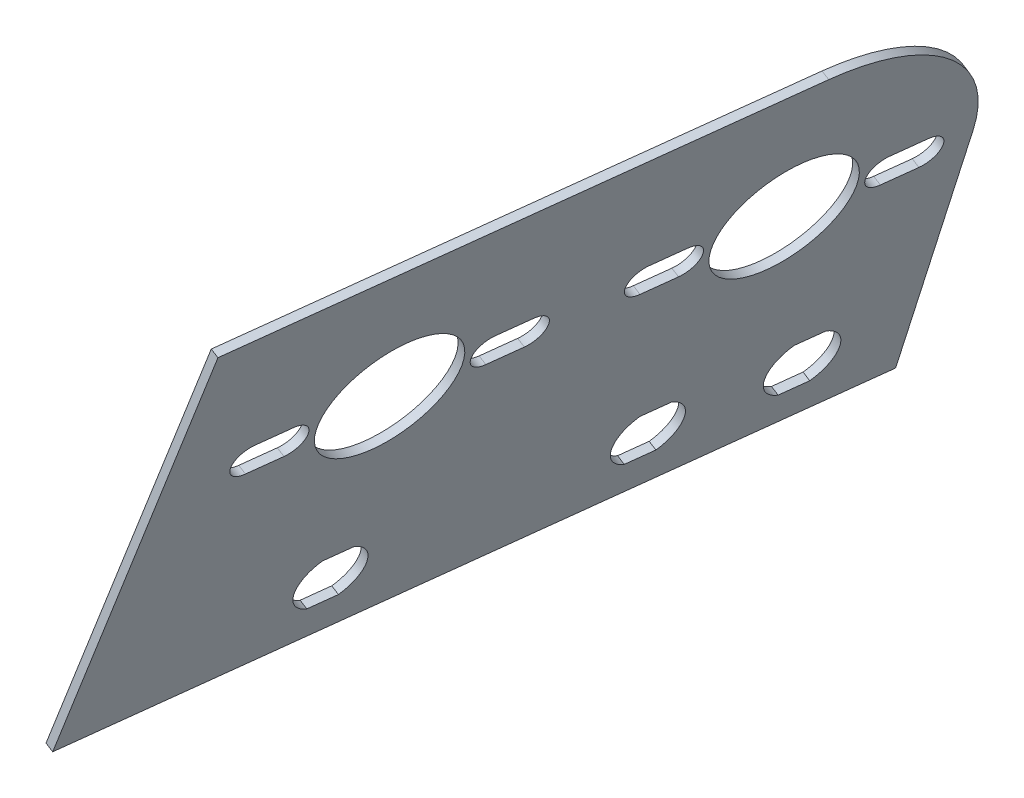
from build123d import *

# Parameters (mm, degrees)
SKETCH39_R          = 12.065
BOSS_EXTRUDE1_DEPTH = 1.5875


with BuildPart() as part:
    # Sketch39 → Boss-Extrude1 (new body)
    with BuildSketch(Plane(origin=(-441.521969452, 172.104793819, -62.182961286), x_dir=(-0.1212218165913434, 0.04725213510134498, 0.9915001295565519), z_dir=(-0.9237984742451071, 0.36009566214142513, -0.1301056996804562))):
        with BuildLine():
            Line((-228.748442373, 213.554448141), (-90.363815922, 201.963804234))
            Line((-90.363815922, 201.963804234), (-90.363815922, 287.351743879))
            Line((-90.363815922, 287.351743879), (-190.640017459, 295.750550698))
            ThreePointArc((-190.640017459, 295.750550698), (-213.325518758, 288.505331466), (-224.243446911, 267.341116014))
            Line((-224.243446911, 267.341116014), (-228.748442373, 213.554448141))
        make_face()
        with Locations((-128.463815922, 259.318927244)):
            Circle(SKETCH39_R, mode=Mode.SUBTRACT)
        with Locations((-193.237014843, 264.74411863)):
            Circle(SKETCH39_R, mode=Mode.SUBTRACT)
        with BuildLine():
            Line((-211.461957069, 230.522345777), (-206.270039744, 230.087487755))
            ThreePointArc((-206.270039744, 230.087487755), (-203.136411518, 224.15373677), (-207.213438794, 218.823926718))
            Line((-207.213438794, 218.823926718), (-212.405356118, 219.25878474))
            ThreePointArc((-212.405356118, 219.25878474), (-215.538984345, 225.192535724), (-211.461957069, 230.522345777))
        make_face(mode=Mode.SUBTRACT)
        with BuildLine():
            Line((-186.168382291, 228.189847508), (-180.976464967, 227.754989487))
            ThreePointArc((-180.976464967, 227.754989487), (-178.017364976, 222.049847551), (-181.884267338, 216.916429257))
            Line((-181.884267338, 216.916429257), (-187.076184662, 217.351287279))
            ThreePointArc((-187.076184662, 217.351287279), (-190.035284653, 223.056429214), (-186.168382291, 228.189847508))
        make_face(mode=Mode.SUBTRACT)
        with BuildLine():
            Line((-215.859429659, 269.914226569), (-209.53158638, 269.384227103))
            ThreePointArc((-209.53158638, 269.384227103), (-206.55149466, 265.859295931), (-210.076425831, 262.879204212))
            Line((-210.076425831, 262.879204212), (-216.40426911, 263.409203678))
            ThreePointArc((-216.40426911, 263.409203678), (-219.38436083, 266.934134849), (-215.859429659, 269.914226569))
        make_face(mode=Mode.SUBTRACT)
        with BuildLine():
            Line((-170.614600027, 259.57401069), (-176.942443306, 260.104010157))
            ThreePointArc((-176.942443306, 260.104010157), (-179.922535026, 263.628941328), (-176.397603855, 266.609033048))
            Line((-176.397603855, 266.609033048), (-170.069760576, 266.079033581))
            ThreePointArc((-170.069760576, 266.079033581), (-167.089668856, 262.55410241), (-170.614600027, 259.57401069))
        make_face(mode=Mode.SUBTRACT)
        with BuildLine():
            Line((-151.086230738, 264.489035183), (-144.758387459, 263.959035717))
            ThreePointArc((-144.758387459, 263.959035717), (-141.778295739, 260.434104546), (-145.30322691, 257.454012826))
            Line((-145.30322691, 257.454012826), (-151.631070189, 257.984012292))
            ThreePointArc((-151.631070189, 257.984012292), (-154.611161909, 261.508943463), (-151.086230738, 264.489035183))
        make_face(mode=Mode.SUBTRACT)
        with BuildLine():
            Line((-105.841401106, 254.148819304), (-112.169244385, 254.678818771))
            ThreePointArc((-112.169244385, 254.678818771), (-115.149336105, 258.203749942), (-111.624404934, 261.183841662))
            Line((-111.624404934, 261.183841662), (-105.296561655, 260.653842195))
            ThreePointArc((-105.296561655, 260.653842195), (-102.316469935, 257.128911024), (-105.841401106, 254.148819304))
        make_face(mode=Mode.SUBTRACT)
        with BuildLine():
            Line((-134.050869929, 223.824655055), (-128.858952604, 223.389797033))
            ThreePointArc((-128.858952604, 223.389797033), (-125.899852614, 217.684655097), (-129.766754976, 212.551236803))
            Line((-129.766754976, 212.551236803), (-134.9586723, 212.986094825))
            ThreePointArc((-134.9586723, 212.986094825), (-137.917772291, 218.691236761), (-134.050869929, 223.824655055))
        make_face(mode=Mode.SUBTRACT)
    extrude(amount=BOSS_EXTRUDE1_DEPTH)


solid = part.part
